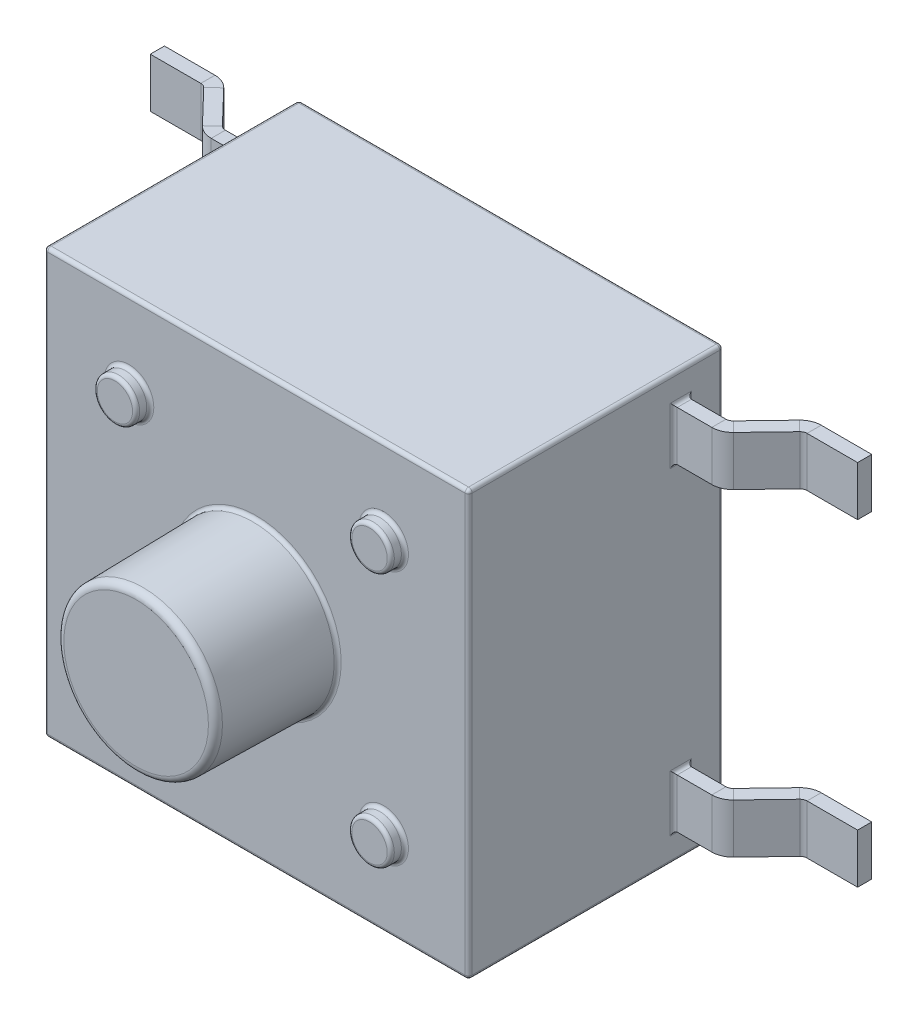
from build123d import *

# Parameters (mm, degrees)
SKETCH1_W               = 6
SKETCH1_H               = 6
BOSS_EXTRUDE1_DEPTH     = 3.3
SKETCH2_W               = 6
SKETCH2_H               = 6
BOSS_EXTRUDE2_DEPTH     = 0.3
SKETCH3_R               = 0.3
BOSS_EXTRUDE3_DEPTH     = 0.2
SKETCH4_R               = 1.15
BOSS_EXTRUDE4_DEPTH     = 1.7
BOSS_EXTRUDE4_TAPER     = 1
SKETCH6_W               = 0.2
SKETCH6_H               = 0.7
MIRROR2_COPY_1_SKETCH_W = 0.2
MIRROR2_COPY_1_SKETCH_H = 0.7
FILLET1_R               = 0.1
FILLET2_R               = 0.05
FILLET3_R               = 0.05


with BuildPart() as part:
    # Sketch1 → Boss-Extrude1 (new body)
    with BuildSketch(Plane.XY):
        Rectangle(SKETCH1_W, SKETCH1_H)
    extrude(amount=BOSS_EXTRUDE1_DEPTH)

    # Sketch2 → Boss-Extrude2 (add)
    with BuildSketch(Plane.XY.offset(3.3)):
        Rectangle(SKETCH2_W, SKETCH2_H)
    extrude(amount=BOSS_EXTRUDE2_DEPTH)

    # Sketch3 → Boss-Extrude3 (add)
    with BuildSketch(Plane.XY.offset(3.6)):
        with Locations((-1.8, 1.8)):
            Circle(SKETCH3_R)
        with Locations(Location((1.8, 1.8, 0), (0, 0, 180))):
            Circle(SKETCH3_R)
        with Locations((1.8, -1.8)):
            Circle(SKETCH3_R)
        with Locations(Location((-1.8, -1.8, 0), (0, 0, 180))):
            Circle(SKETCH3_R)
    extrude(amount=BOSS_EXTRUDE3_DEPTH)

    # Sketch4 → Boss-Extrude4 (add)
    with BuildSketch(Plane.XY.offset(3.6)):
        Circle(SKETCH4_R)
    extrude(amount=BOSS_EXTRUDE4_DEPTH, taper=BOSS_EXTRUDE4_TAPER)

    # Sweep4: sweep along a path in Sketch5
    with BuildLine(Plane(origin=(0, 0, 0), x_dir=(1, 0, 0), z_dir=(0, 1, 0))) as sweep4_path:
        Line((3, -0.6), (3.538870936, -0.6))
        ThreePointArc((3.538870936, -0.6), (3.617298994, -0.583981085), (3.683163729, -0.538490397))
        Line((3.683163729, -0.538490397), (4.140963861, -0.061509603))
        ThreePointArc((4.140963861, -0.061509603), (4.206828595, -0.016018915), (4.285256654, 0))
        Line((4.285256654, 0), (5, 0))
    # Sketch6 → Sweep4 (sweep)
    with BuildSketch(Plane(origin=(3, 0, 0), x_dir=(0, 0, -1), z_dir=(1, 0, 0))):
        with Locations((-0.6, 2.25)):
            Rectangle(SKETCH6_W, SKETCH6_H)
    sweep4 = sweep(path=sweep4_path.line)

    # Mirror1: Sweep4 across plane
    add(sweep4.mirror(Plane.ZX))

    # Mirror2: Sweep4 across plane
    add(sweep4.mirror(Plane(origin=(0, 0, 0), x_dir=(0, 0, 1), z_dir=(1, 0, 0))))

    # Mirror2 copy 1: sweep along a path in Mirror2 copy 1 path
    with BuildLine(Plane(origin=(0, 0, 0), x_dir=(-1, 0, 0), z_dir=(0, -1, 0))) as mirror2_copy_1_path:
        Line((3, -0.6), (3.538870936, -0.6))
        ThreePointArc((3.538870936, -0.6), (3.617298994, -0.583981085), (3.683163729, -0.538490397))
        Line((3.683163729, -0.538490397), (4.140963861, -0.061509603))
        ThreePointArc((4.140963861, -0.061509603), (4.206828595, -0.016018915), (4.285256654, 0))
        Line((4.285256654, 0), (5, 0))
    # Mirror2 copy 1 sketch → Mirror2 copy 1 (sweep)
    with BuildSketch(Plane(origin=(-3, 0, 0), x_dir=(0, 0, -1), z_dir=(-1, 0, 0))):
        with Locations((-0.6, 2.25)):
            Rectangle(MIRROR2_COPY_1_SKETCH_W, MIRROR2_COPY_1_SKETCH_H)
    sweep(path=mirror2_copy_1_path.line)

    # Fillet1
    fillet1_edges = [part.edges().sort_by_distance(p)[0] for p in [
        (-1.12032639, 0, 5.3),
    ]]
    fillet(fillet1_edges, radius=FILLET1_R)

    # Fillet2
    fillet2_edges = [part.edges().sort_by_distance(p)[0] for p in [
        (-2.1, 1.8, 3.8),
        (2.1, 1.8, 3.8),
        (1.5, -1.8, 3.8),
        (-1.5, -1.8, 3.8),
    ]]
    fillet(fillet2_edges, radius=FILLET2_R)

    # Fillet3
    fillet3_edges = [part.edges().sort_by_distance(p)[0] for p in [
        (-3, 2.25, 0.5),
        (-3, 1.9, 0.6),
        (-3, 2.25, 0.7),
        (-3, 2.6, 0.6),
        (-3, -2.25, 0.7),
        (-3, -1.9, 0.6),
        (-3, -2.25, 0.5),
        (-3, -2.6, 0.6),
        (3, 0, 3.6),
        (0, 3, 3.6),
        (-3, 0, 3.6),
        (0, -3, 3.6),
        (-2.1, 1.8, 3.6),
        (2.1, 1.8, 3.6),
        (1.5, -1.8, 3.6),
        (-1.5, -1.8, 3.6),
        (-1.15, 0, 3.6),
        (3, 2.25, 0.7),
        (3, 1.9, 0.6),
        (3, 2.25, 0.5),
        (3, 2.6, 0.6),
        (0, -3, 0),
        (-3, 0, 0),
        (0, 3, 0),
        (3, 0, 0),
        (3, -3, 1.8),
        (3, -2.25, 0.5),
        (3, -1.9, 0.6),
        (3, -2.25, 0.7),
        (3, -2.6, 0.6),
        (-3, -3, 1.8),
        (-3, 3, 1.8),
        (3, 3, 1.8),
    ]]
    fillet(fillet3_edges, radius=FILLET3_R)


solid = part.part
